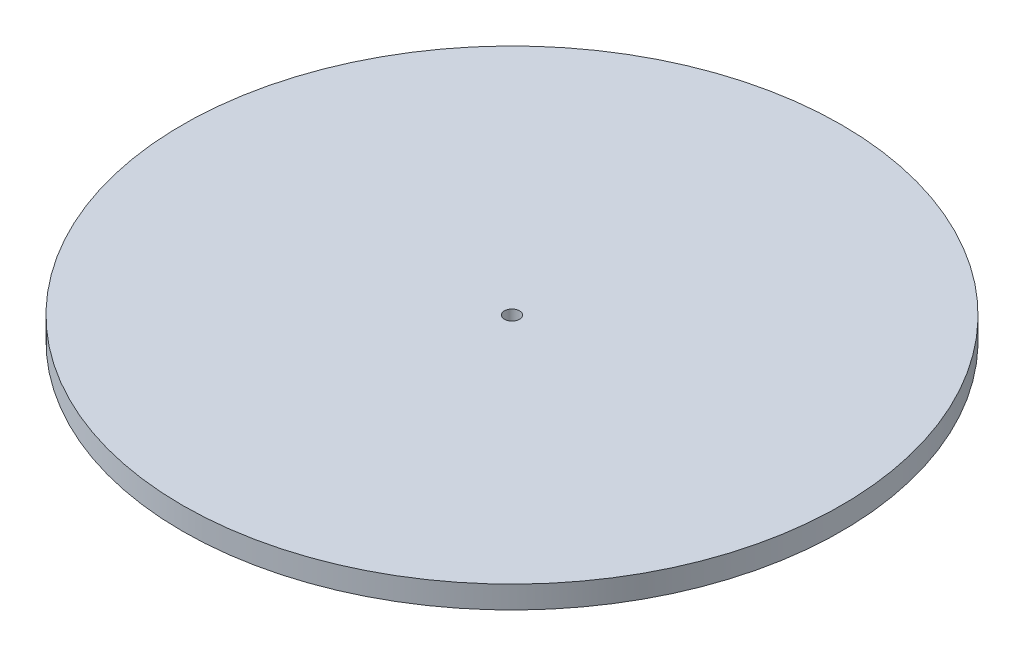
from build123d import *

# Parameters (mm, degrees)
BASEPLATE_R         = 279.945595429
BOSS_EXTRUDE1_DEPTH = 19.05
CUT_EXTRUDE1_REACH  = 398.361
CENTERHOLE_R        = 6.35


with BuildPart() as part:
    # BasePlate → Boss-Extrude1 (new body)
    with BuildSketch(Plane(origin=(0, 0, 0), x_dir=(1, 0, 0), z_dir=(0, 1, 0))):
        with Locations(Location((0, 0, 0), (0, 0, 90))):
            Circle(BASEPLATE_R)
    extrude(amount=BOSS_EXTRUDE1_DEPTH)

    # CenterHole → Cut-Extrude1 (cut, up to next)
    with BuildSketch(Plane(origin=(0, 19.05, 0), x_dir=(1, 0, 0), z_dir=(0, 1, 0)), mode=Mode.PRIVATE) as cut_extrude1_sk1:
        with Locations(Location((0, 0, 0), (0, 0, 270))):
            Circle(CENTERHOLE_R)
    cut_extrude1_tool1 = extrude(cut_extrude1_sk1.sketch, amount=-CUT_EXTRUDE1_REACH, mode=Mode.PRIVATE) & part.part
    add(cut_extrude1_tool1.solids().sort_by_distance((0, 19.05, 0))[0], mode=Mode.SUBTRACT)


solid = part.part
